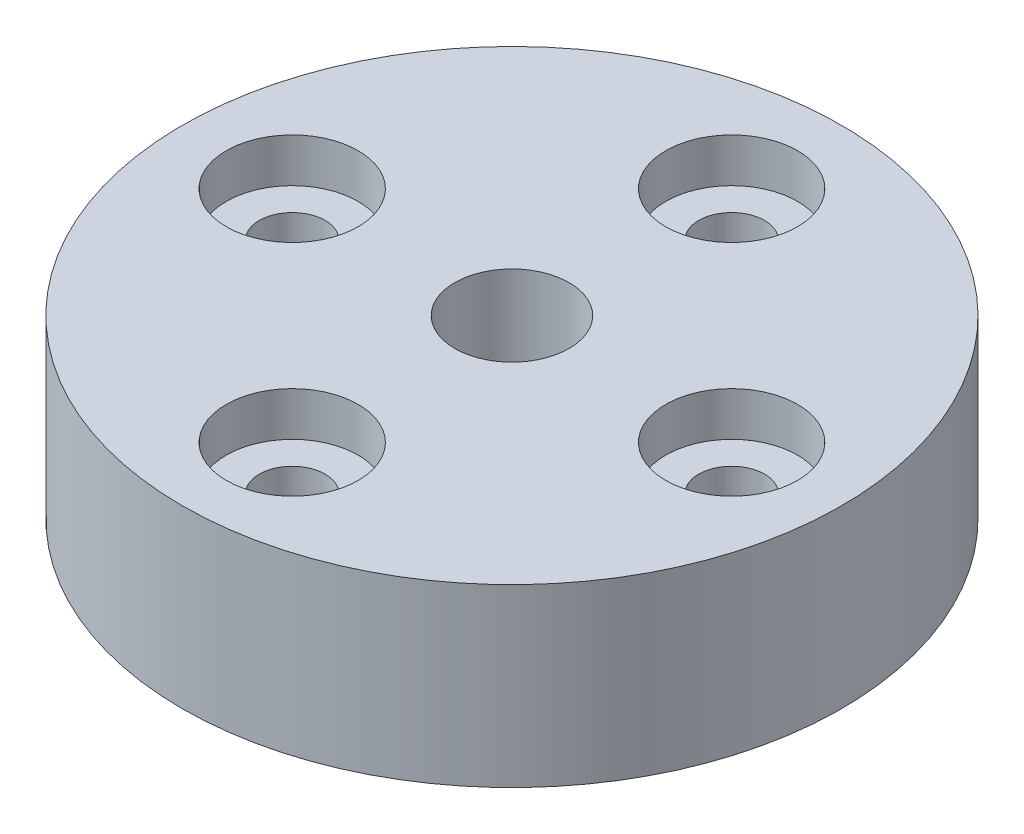
from build123d import *

# Parameters (mm, degrees)
SKETCH1_R           = 15
SKETCH1_R_2         = 1.5
BOSS_EXTRUDE1_DEPTH = 8
SKETCH2_R           = 2.6
CUT_EXTRUDE1_DEPTH  = 23.671568098
CUT_EXTRUDE2_START  = -2
SKETCH3_R           = 3
SKETCH3_R_2         = 1.5
CUT_EXTRUDE2_DEPTH  = 2
SKETCH4_R           = 3
CUT_EXTRUDE3_DEPTH  = 2


with BuildPart() as part:
    # Sketch1 → Boss-Extrude1 (new body)
    with BuildSketch(Plane(origin=(0, 0, 0), x_dir=(1, 0, 0), z_dir=(0, 1, 0))):
        with Locations(Location((0, 0, 0), (0, 0, 270))):
            Circle(SKETCH1_R)
        with Locations(Location((0, 10, 0), (0, 0, 270))):
            Circle(SKETCH1_R_2, mode=Mode.SUBTRACT)
        with Locations(Location((10, 0, 0), (0, 0, 270))):
            Circle(SKETCH1_R_2, mode=Mode.SUBTRACT)
        with Locations(Location((0, -10, 0), (0, 0, 270))):
            Circle(SKETCH1_R_2, mode=Mode.SUBTRACT)
        with Locations(Location((-10, 0, 0), (0, 0, 270))):
            Circle(SKETCH1_R_2, mode=Mode.SUBTRACT)
    extrude(amount=BOSS_EXTRUDE1_DEPTH)

    # Sketch2 → Cut-Extrude1 (cut, through all)
    with BuildSketch(Plane(origin=(0, 8, 0), x_dir=(1, 0, 0), z_dir=(0, 1, 0))):
        with Locations(Location((0, 0, 0), (0, 0, 270))):
            Circle(SKETCH2_R)
    extrude(amount=-CUT_EXTRUDE1_DEPTH, mode=Mode.SUBTRACT)

    # Sketch3 → Cut-Extrude2 (cut)
    # profile 1 of 4: a face of its own
    with BuildSketch(Plane(origin=(0, 8, 0), x_dir=(1, 0, 0), z_dir=(0, 1, 0)).offset(CUT_EXTRUDE2_START)):
        with Locations(Location((-10, 0, 0), (0, 0, 270))):
            Circle(SKETCH3_R)
        with Locations(Location((-10, 0, 0), (0, 0, 270))):
            Circle(SKETCH3_R_2, mode=Mode.SUBTRACT)
    # profile 2 of 4: a face of its own
    with BuildSketch(Plane(origin=(0, 8, 0), x_dir=(1, 0, 0), z_dir=(0, 1, 0)).offset(CUT_EXTRUDE2_START)):
        with Locations(Location((0, -10, 0), (0, 0, 270))):
            Circle(SKETCH3_R)
        with Locations(Location((0, -10, 0), (0, 0, 270))):
            Circle(SKETCH3_R_2, mode=Mode.SUBTRACT)
    # profile 3 of 4: a face of its own
    with BuildSketch(Plane(origin=(0, 8, 0), x_dir=(1, 0, 0), z_dir=(0, 1, 0)).offset(CUT_EXTRUDE2_START)):
        with Locations(Location((10, 0, 0), (0, 0, 270))):
            Circle(SKETCH3_R)
        with Locations(Location((10, 0, 0), (0, 0, 270))):
            Circle(SKETCH3_R_2, mode=Mode.SUBTRACT)
    # profile 4 of 4: a face of its own
    with BuildSketch(Plane(origin=(0, 8, 0), x_dir=(1, 0, 0), z_dir=(0, 1, 0)).offset(CUT_EXTRUDE2_START)):
        with Locations(Location((0, 10, 0), (0, 0, 270))):
            Circle(SKETCH3_R)
    extrude(amount=CUT_EXTRUDE2_DEPTH, mode=Mode.SUBTRACT)

    # Sketch4 → Cut-Extrude3 (cut)
    with BuildSketch(Plane.XZ):
        with Locations(Location((0, 10, 0), (0, 0, 90))):
            Circle(SKETCH4_R)
        with Locations(Location((10, 0, 0), (0, 0, 90))):
            Circle(SKETCH4_R)
        with Locations(Location((0, -10, 0), (0, 0, 90))):
            Circle(SKETCH4_R)
        with Locations(Location((-10, 0, 0), (0, 0, 90))):
            Circle(SKETCH4_R)
    extrude(amount=-CUT_EXTRUDE3_DEPTH, mode=Mode.SUBTRACT)


solid = part.part
